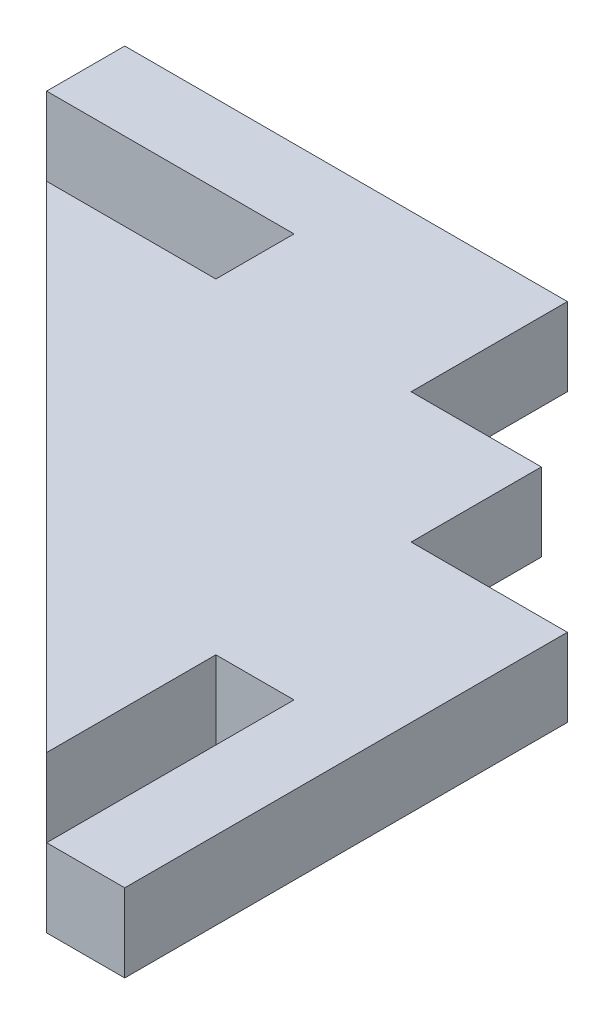
from build123d import *

# Parameters (mm, degrees)
BOSS_EXTRUDE1_DEPTH = 6
SKETCH3_W           = 19
SKETCH3_H           = 6
SKETCH3_W_2         = 6
SKETCH3_H_2         = 19
CUT_EXTRUDE1_DEPTH  = 71.964779997
SKETCH4_W           = 6
SKETCH4_H           = 6
CUT_EXTRUDE2_DEPTH  = 71.964779997


with BuildPart() as part:
    # Sketch2 → Boss-Extrude1 (new body)
    with BuildSketch(Plane(origin=(0, 0, 0), x_dir=(1, 0, 0), z_dir=(0, 1, 0))):
        Polygon((0, 0), (-10, 0), (-10, 12), (-50, 12), (12, -50), (12, -10), (0, -10), align=None)
    extrude(amount=BOSS_EXTRUDE1_DEPTH)

    # Sketch3 → Cut-Extrude1 (cut, through all)
    with BuildSketch(Plane(origin=(0, 6, 0), x_dir=(1, 0, 0), z_dir=(0, 1, 0))):
        with Locations((-34.5, 3)):
            Rectangle(SKETCH3_W, SKETCH3_H)
        with Locations((3, -34.5)):
            Rectangle(SKETCH3_W_2, SKETCH3_H_2)
    extrude(amount=-CUT_EXTRUDE1_DEPTH, mode=Mode.SUBTRACT)

    # Sketch4 → Cut-Extrude2 (cut, through all)
    with BuildSketch(Plane(origin=(0, 6, 0), x_dir=(1, 0, 0), z_dir=(0, 1, 0))):
        with Locations((-47, 9)):
            Rectangle(SKETCH4_W, SKETCH4_H)
        with Locations((9, -47)):
            Rectangle(SKETCH4_W, SKETCH4_H)
    extrude(amount=-CUT_EXTRUDE2_DEPTH, mode=Mode.SUBTRACT)


solid = part.part
